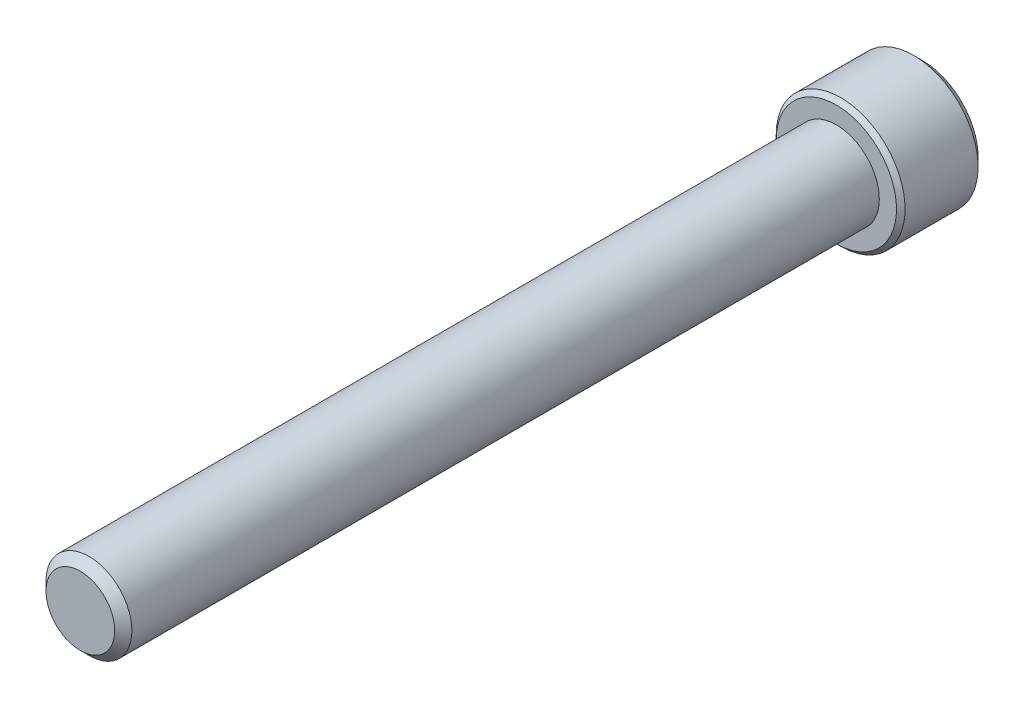
from build123d import *

# Parameters (mm, degrees)
SKETCH1_R          = 3.96875
EXTRUDE1_DEPTH     = 69.85
CHAMFER3_SIZE      = 0.79375
SKETCH6_R          = 5.953125
EXTRUDE2_DEPTH     = 7.9375
CUT_EXTRUDE1_DEPTH = 4.7625
SKETCH8_R          = 3.666174209
CUT_EXTRUDE2_DEPTH = 0.79375
CUT_EXTRUDE2_DRAFT = -45
CHAMFER1_SIZE      = 0.79375
CHAMFER2_SIZE      = 0.396875


with BuildPart() as part:
    # Sketch1 → Extrude1 (new body)
    with BuildSketch(Plane.XY):
        Circle(SKETCH1_R)
    extrude(amount=-EXTRUDE1_DEPTH)

    # Chamfer3
    chamfer3_edges = [part.edges().sort_by_distance(p)[0] for p in [
        (-3.96875, 0, 0),
    ]]
    chamfer(chamfer3_edges, length=CHAMFER3_SIZE)

    # Sketch5 → partially thread (revolve)
    with BuildSketch(Plane(origin=(0, 0, 0), x_dir=(0, 0, -1), z_dir=(1, 0, 0))):
        Polygon((69.85, 3.96875), (28.575, 3.96875), (24.60625, 0), (28.575, 0), (69.85, 0), align=None)
    revolve(axis=Axis((0, 0, 0), (0, 0, -1)))

    # Sketch6 → Extrude2 (add)
    with BuildSketch(Plane(origin=(0, 0, -69.85), x_dir=(-1, 0, 0), z_dir=(0, 0, -1))):
        Circle(SKETCH6_R)
    extrude(amount=EXTRUDE2_DEPTH)

    # Sketch7 → Cut-Extrude1 (cut)
    with BuildSketch(Plane(origin=(0, 0, -77.7875), x_dir=(-1, 0, 0), z_dir=(0, 0, -1))):
        Polygon((0, 3.666174209), (-3.175, 1.833087105), (-3.175, -1.833087105), (0, -3.666174209), (3.175, -1.833087105), (3.175, 1.833087105), align=None)
    extrude(amount=-CUT_EXTRUDE1_DEPTH, mode=Mode.SUBTRACT)


with BuildPart() as cut_extrude2_tool:
    # Sketch8 → Cut-Extrude2 (with draft: the straight prism first)
    with BuildSketch(Plane(origin=(0, 0, -77.7875), x_dir=(-1, 0, 0), z_dir=(0, 0, -1))):
        Circle(SKETCH8_R)
    extrude(amount=-CUT_EXTRUDE2_DEPTH)
    # Cut-Extrude2: the draft: its side faces are tilted about the plane it starts from
    cut_extrude2_sides = [cut_extrude2_tool.faces().sort_by_distance(p)[0] for p in [
        (3.666174209, 0, -77.390625),
    ]]
    draft(cut_extrude2_sides, Plane(origin=(0, 0, -77.7875), x_dir=(-1, 0, 0), z_dir=(0, 0, -1)), CUT_EXTRUDE2_DRAFT)


with BuildPart() as part_1:
    add(part.part)

    # Cut-Extrude2: cut by cut_extrude2_tool
    add(cut_extrude2_tool.part, mode=Mode.SUBTRACT)

    # Chamfer1
    chamfer1_edges = [part_1.edges().sort_by_distance(p)[0] for p in [
        (5.953125, 0, -77.7875),
    ]]
    chamfer(chamfer1_edges, length=CHAMFER1_SIZE)

    # Chamfer2
    chamfer2_edges = [part_1.edges().sort_by_distance(p)[0] for p in [
        (5.953125, 0, -69.85),
    ]]
    chamfer(chamfer2_edges, length=CHAMFER2_SIZE)


solid = part_1.part
